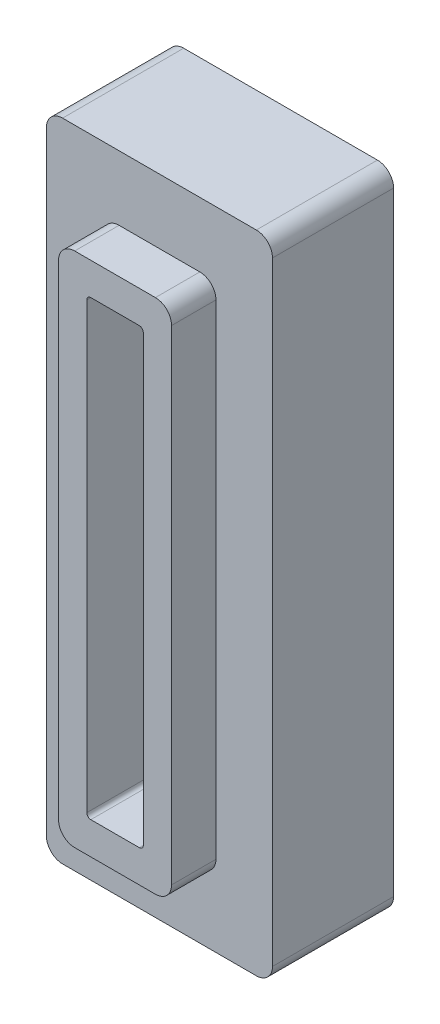
from build123d import *

# Parameters (mm, degrees)
SKETCH1_W      = 14
SKETCH1_H      = 40
SKETCH1_W_2    = 3.5
SKETCH1_H_2    = 28
EXTRUDE1_DEPTH = 1.5
SKETCH2_W      = 7
SKETCH2_H      = 32
SKETCH2_W_2    = 3.5
SKETCH2_H_2    = 28
EXTRUDE2_DEPTH = 2.75
SKETCH3_W      = 14
SKETCH3_H      = 40
SKETCH3_W_2    = 9.8
SKETCH3_H_2    = 35.4
EXTRUDE3_DEPTH = 6
FILLET1_R      = 0.25
FILLET2_R      = 1


with BuildPart() as part:
    # Sketch1 → Extrude1 (new body)
    with BuildSketch(Plane.XY):
        Rectangle(SKETCH1_W, SKETCH1_H)
        Rectangle(SKETCH1_W_2, SKETCH1_H_2, mode=Mode.SUBTRACT)
    extrude(amount=EXTRUDE1_DEPTH)

    # Sketch2 → Extrude2 (add)
    with BuildSketch(Plane.XY.offset(1.5)):
        Rectangle(SKETCH2_W, SKETCH2_H)
        Rectangle(SKETCH2_W_2, SKETCH2_H_2, mode=Mode.SUBTRACT)
    extrude(amount=EXTRUDE2_DEPTH)

    # Sketch3 → Extrude3 (add)
    with BuildSketch(Plane(origin=(0, 0, 0), x_dir=(-1, 0, 0), z_dir=(0, 0, -1))):
        Rectangle(SKETCH3_W, SKETCH3_H)
        Rectangle(SKETCH3_W_2, SKETCH3_H_2, mode=Mode.SUBTRACT)
    extrude(amount=EXTRUDE3_DEPTH)

    # Fillet1
    fillet1_edges = [part.edges().sort_by_distance(p)[0] for p in [
        (1.75, -14, 2.125),
        (1.75, 14, 2.125),
        (-1.75, 14, 2.125),
        (-1.75, -14, 2.125),
        (-4.9, 17.7, -3),
        (4.9, 17.7, -3),
        (4.9, -17.7, -3),
        (-4.9, -17.7, -3),
    ]]
    fillet(fillet1_edges, radius=FILLET1_R)

    # Fillet2
    fillet2_edges = [part.edges().sort_by_distance(p)[0] for p in [
        (3.5, -16, 2.875),
        (3.5, 16, 2.875),
        (-3.5, 16, 2.875),
        (-3.5, -16, 2.875),
        (7, -20, -2.25),
        (-7, -20, -2.25),
        (-7, 20, -2.25),
        (7, 20, -2.25),
    ]]
    fillet(fillet2_edges, radius=FILLET2_R)


solid = part.part
